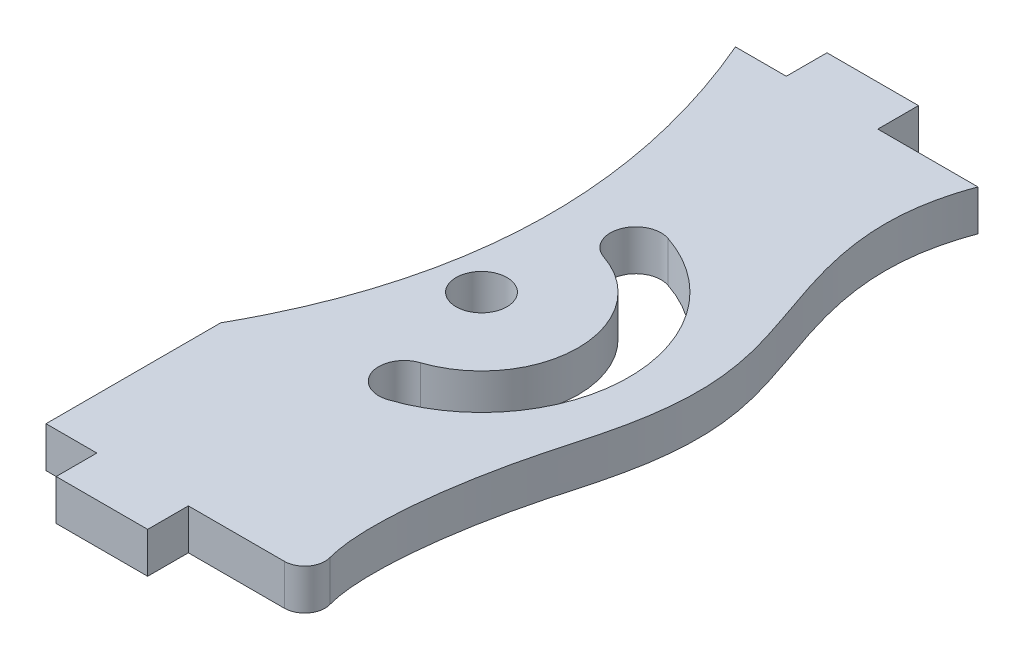
from build123d import *

# Parameters (mm, degrees)
CROQUIS1_R              = 1.25
SALIENTE_EXTRUIR1_DEPTH = 2


with BuildPart() as part:
    # Croquis1 → Saliente-Extruir1 (new body)
    with BuildSketch(Plane(origin=(0, 0, 0), x_dir=(1, 0, 0), z_dir=(0, 1, 0))):
        with BuildLine():
            Line((-4.20050822, 16.689223124), (-1.70050822, 16.689223124))
            Line((-1.70050822, 16.689223124), (-1.70050822, 18.689223124))
            Line((-1.70050822, 18.689223124), (2.79949178, 18.689223124))
            Line((2.79949178, 18.689223124), (2.79949178, 16.689223124))
            Line((2.79949178, 16.689223124), (7.726600223, 16.689223124))
            add(Edge.make_bspline(
                [(7.577707829, -15.040023689), (7.009095125, -13.018350945), (7.479696929, -8.281838807), (9.837054162, -0.269934456), (9.506886296, 5.625743932), (5.899776863, 11.831578143), (7.726600223, 16.689223124)],
                knots=[0.078667813, 0.078667813, 0.078667813, 0.078667813, 0.337938342, 0.393992599, 0.639210385, 1, 1, 1, 1], degree=3))
            ThreePointArc((7.577707829, -15.040023689), (7.412164162, -15.914617423), (6.615059029, -16.310776876))
            Line((6.615059029, -16.310776876), (1.893728582, -16.310776876))
            Line((1.893728582, -16.310776876), (1.893728582, -18.310776876))
            Line((1.893728582, -18.310776876), (-2.606271418, -18.310776876))
            Line((-2.606271418, -18.310776876), (-2.606271418, -16.310776876))
            Line((-2.606271418, -16.310776876), (-5.106271418, -16.310776876))
            Line((-5.106271418, -16.310776876), (-5.106271418, -7.718861624))
            add(Edge.make_bspline(
                [(-4.20050822, 16.689223124), (1.327651649, 3.755856275), (-5.106271418, -7.718861624)],
                knots=[0, 0, 0, 1, 1, 1], degree=2))
        make_face()
        with Locations(Location((0, 0, 0), (0, 0, 270))):
            Circle(CROQUIS1_R, mode=Mode.SUBTRACT)
        with BuildLine():
            ThreePointArc((2.286674037, -6.879943448), (7.25, 0), (2.286674037, 6.879943448))
            ThreePointArc((2.286674037, 6.879943448), (0.706222747, 6.088000446), (1.498165749, 4.507549156))
            ThreePointArc((1.498165749, 4.507549156), (4.75, 0), (1.498165749, -4.507549156))
            ThreePointArc((1.498165749, -4.507549156), (0.706222747, -6.088000446), (2.286674037, -6.879943448))
        make_face(mode=Mode.SUBTRACT)
    extrude(amount=SALIENTE_EXTRUIR1_DEPTH)


solid = part.part
